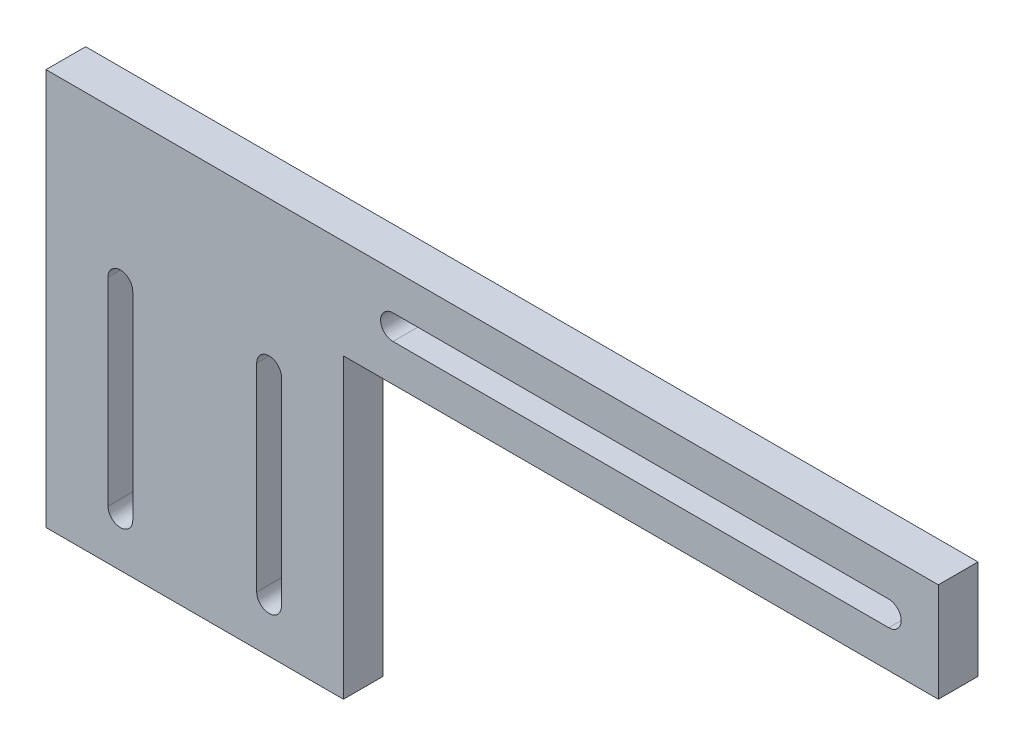
from build123d import *

# Parameters (mm, degrees)
BOSS_EXTRUDE2_DEPTH = 5.08


with BuildPart() as part:
    # Sketch1 → Boss-Extrude2 (new body)
    with BuildSketch(Plane.XY):
        Polygon((0, 0), (38.1, 0), (38.1, 38.1), (114.3, 38.1), (114.3, 50.8), (0, 50.8), align=None)
        with BuildLine():
            Line((7.9375, 6.35), (7.9375, 31.75))
            ThreePointArc((7.9375, 31.75), (9.525, 33.3375), (11.1125, 31.75))
            Line((11.1125, 31.75), (11.1125, 6.35))
            ThreePointArc((11.1125, 6.35), (9.525, 4.7625), (7.9375, 6.35))
        make_face(mode=Mode.SUBTRACT)
        with BuildLine():
            Line((30.1625, 31.75), (30.1625, 6.35))
            ThreePointArc((30.1625, 6.35), (28.575, 4.7625), (26.9875, 6.35))
            Line((26.9875, 6.35), (26.9875, 31.75))
            ThreePointArc((26.9875, 31.75), (28.575, 33.3375), (30.1625, 31.75))
        make_face(mode=Mode.SUBTRACT)
        with BuildLine():
            Line((107.95, 42.8625), (44.45, 42.8625))
            ThreePointArc((44.45, 42.8625), (42.8625, 44.45), (44.45, 46.0375))
            Line((44.45, 46.0375), (107.95, 46.0375))
            ThreePointArc((107.95, 46.0375), (109.5375, 44.45), (107.95, 42.8625))
        make_face(mode=Mode.SUBTRACT)
    extrude(amount=BOSS_EXTRUDE2_DEPTH)


solid = part.part
